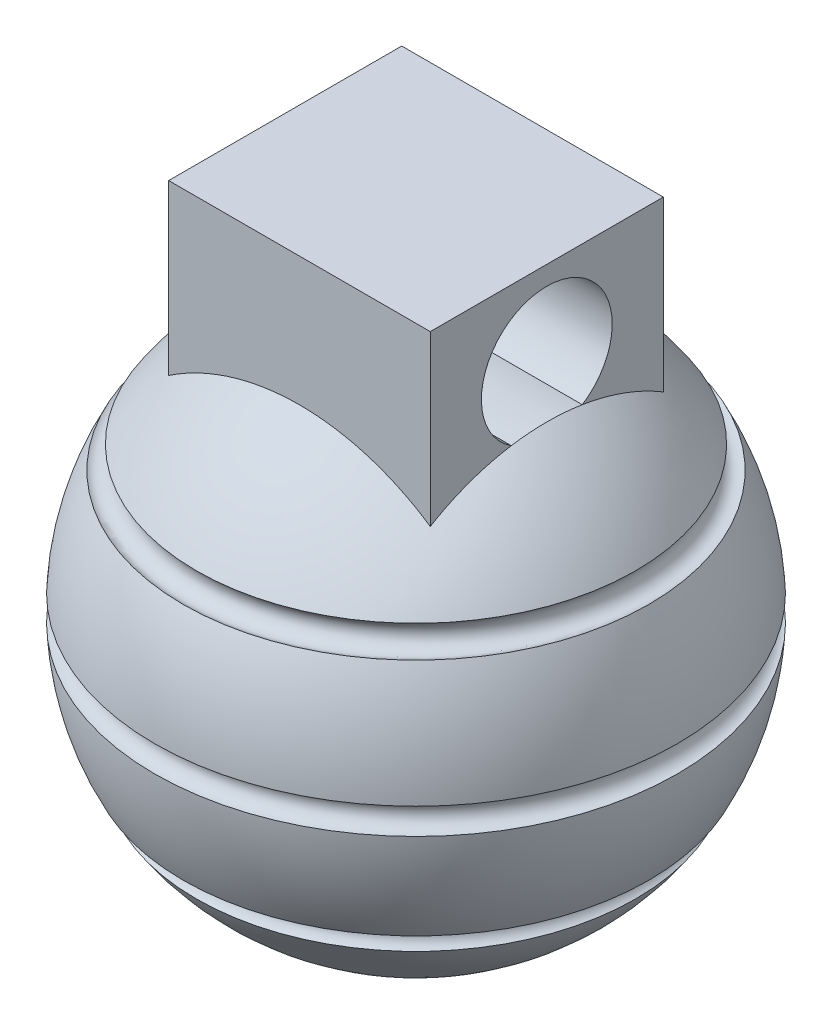
from build123d import *

# Parameters (mm, degrees)
ESQUISSE4_R             = 1
ESQUISSE9_R             = 1
BOSS_EXTRU_4_DEPTH      = 10
BOSS_EXTRU_4_DEPTH_BACK = 10
ESQUISSE11_W            = 17.81684603
ESQUISSE11_H            = 15.516188122
ENL_V_MAT_EXTRU_1_DEPTH = 46.475411333


with BuildPart() as part:
    # Esquisse1 → Révolution1 (revolve)
    with BuildSketch(Plane.XY):
        with BuildLine():
            Line((0, 20), (0, -20))
            ThreePointArc((0, -20), (-20, 0), (0, 20))
        make_face()
    revolve(axis=Axis((0, 20, 0), (0, -1, 0)))

    # Enlèvement de matière-Balayage1: sweep along a path in Esquisse5
    with BuildLine(Plane(origin=(0, 0, 0), x_dir=(1, 0, 0), z_dir=(0, 1, 0))) as enl_vement_de_mati_re_balayage1_path:
        CenterArc((0, 0), 20, 0, 360)
    # Esquisse4 → Enlèvement de matière-Balayage1 (sweep, cut)
    with BuildSketch(Plane.XY):
        with Locations((20, 0)):
            Circle(ESQUISSE4_R)
    sweep(path=enl_vement_de_mati_re_balayage1_path.line, mode=Mode.SUBTRACT)

    # Enlèvement de matière-Balayage2: sweep along a path in Esquisse8
    with BuildLine(Plane(origin=(0, 10, 0), x_dir=(1, 0, 0), z_dir=(0, 1, 0))) as enl_vement_de_mati_re_balayage2_path:
        CenterArc((0, 0), 17.29903491, 0, 360)
    # Esquisse9 → Enlèvement de matière-Balayage2 (sweep, cut)
    with BuildSketch(Plane(origin=(0, 0, 0), x_dir=(0, 0, -1), z_dir=(1, 0, 0))):
        with Locations((-17.29903491, 10)):
            Circle(ESQUISSE9_R)
    enl_vement_de_mati_re_balayage2 = sweep(path=enl_vement_de_mati_re_balayage2_path.line, mode=Mode.SUBTRACT)

    # Symétrie1: Enlèvement de matière-Balayage2 across plane
    add(enl_vement_de_mati_re_balayage2.mirror(Plane.ZX), mode=Mode.SUBTRACT)

    # Esquisse11 → Boss.-Extru.4 (add, two sides: drawn at the far end of the back side and taken through both)
    with BuildSketch(Plane(origin=(0, 0, 0), x_dir=(0, 0, -1), z_dir=(1, 0, 0)).offset(-BOSS_EXTRU_4_DEPTH_BACK)):
        with Locations((0, 20)):
            Rectangle(ESQUISSE11_W, ESQUISSE11_H)
    extrude(amount=BOSS_EXTRU_4_DEPTH + BOSS_EXTRU_4_DEPTH_BACK)

    # Esquisse12 → Enlèv. mat.-Extru.1 (cut, through all)
    with BuildSketch(Plane(origin=(10, 0, 0), x_dir=(0, 0, -1), z_dir=(1, 0, 0))):
        with BuildLine():
            ThreePointArc((5, 21.306024871), (0, 26.306024871), (-5, 21.306024871))
            ThreePointArc((-5, 21.306024871), (-4.39141224, 18.915313985), (-2.713800585, 17.106586053))
            ThreePointArc((-2.713800585, 17.106586053), (0, 17.320508076), (2.713800585, 17.106586053))
            ThreePointArc((2.713800585, 17.106586053), (4.39141224, 18.915313985), (5, 21.306024871))
        make_face()
    extrude(amount=-ENL_V_MAT_EXTRU_1_DEPTH, mode=Mode.SUBTRACT)


solid = part.part
